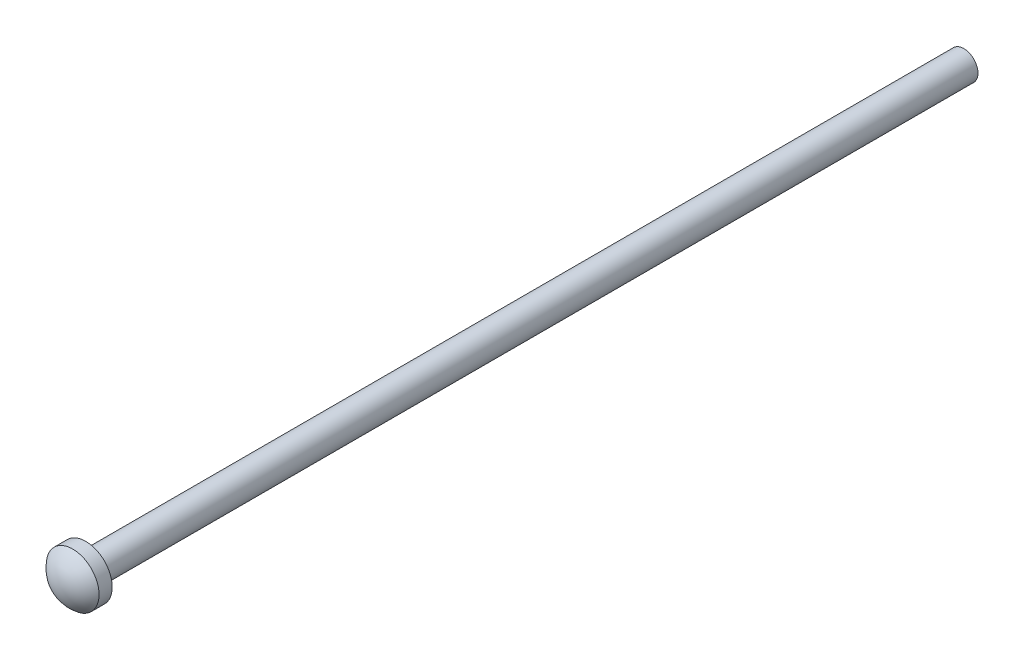
from build123d import *

# Parameters (mm, degrees)
SKETCH1_R           = 3.25
SKETCH3_R           = 6
BOSS_EXTRUDE1_DEPTH = 3
DOME1_FACE_RADIUS   = 6
DOME1_HEIGHT        = 3


with BuildPart() as part:
    # Sweep1: sweep along a path in Sketch2
    with BuildLine(Plane(origin=(0, 0, 0), x_dir=(0, 0, -1), z_dir=(1, 0, 0))) as sweep1_path:
        Line((0, 0), (200, 0))
    # Sketch1 → Sweep1 (sweep)
    with BuildSketch(Plane.XY):
        with Locations((0, 60)):
            Circle(SKETCH1_R)
    sweep(path=sweep1_path.line)

    # Sketch3 → Boss-Extrude1 (add)
    with BuildSketch(Plane.XY):
        with Locations((0, 60)):
            Circle(SKETCH3_R)
    extrude(amount=BOSS_EXTRUDE1_DEPTH)

    # Dome1: a dome of height H over a round flat face of radius A is a cap of a sphere of radius (A * A + H * H) / (2 * H)
    dome1_r = (DOME1_FACE_RADIUS * DOME1_FACE_RADIUS + DOME1_HEIGHT * DOME1_HEIGHT) / (2 * DOME1_HEIGHT)
    dome1_base = Plane((0, 60, 3), z_dir=(0, 0, 1))
    with Locations(dome1_base.offset(DOME1_HEIGHT - dome1_r)):
        dome1_ball = Sphere(dome1_r, mode=Mode.PRIVATE)
    add(split(dome1_ball, bisect_by=dome1_base, keep=Keep.TOP, mode=Mode.PRIVATE))


solid = part.part
